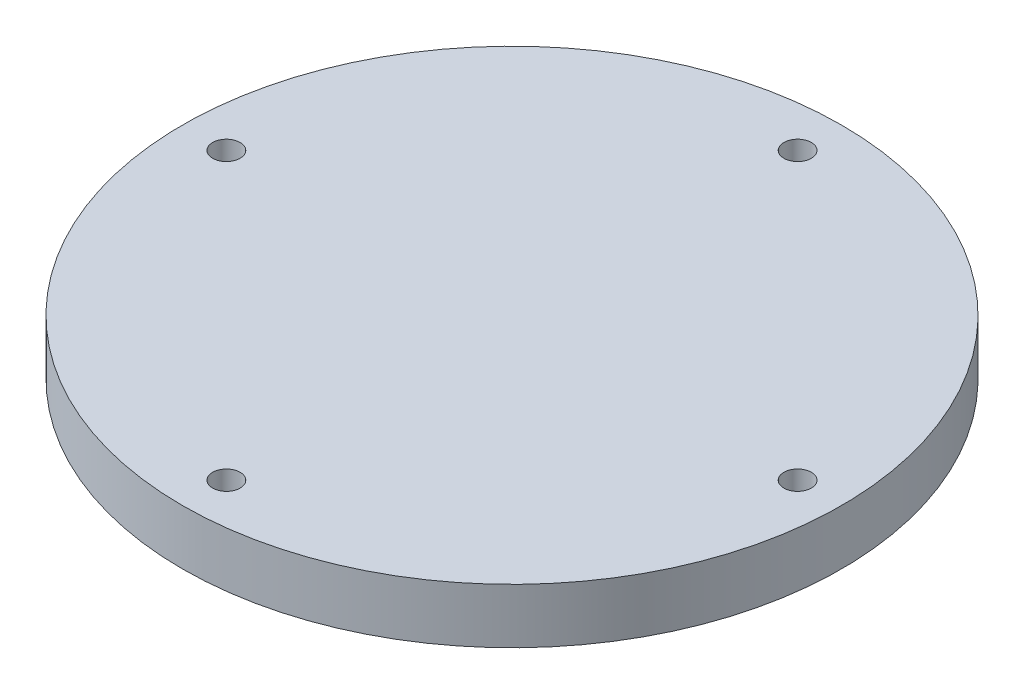
from build123d import *

# Parameters (mm, degrees)
SKETCH1_R           = 38.1
SKETCH1_R_2         = 1.5875
BOSS_EXTRUDE1_DEPTH = 6.35


with BuildPart() as part:
    # Sketch1 → Boss-Extrude1 (new body)
    with BuildSketch(Plane(origin=(0, 0, 0), x_dir=(1, 0, 0), z_dir=(0, 1, 0))):
        with Locations(Location((0, 0, 0), (0, 0, 270))):
            Circle(SKETCH1_R)
        with Locations(Location((0, 33.02, 0), (0, 0, 270))):
            Circle(SKETCH1_R_2, mode=Mode.SUBTRACT)
        with Locations(Location((33.02, 0, 0), (0, 0, 270))):
            Circle(SKETCH1_R_2, mode=Mode.SUBTRACT)
        with Locations(Location((0, -33.02, 0), (0, 0, 270))):
            Circle(SKETCH1_R_2, mode=Mode.SUBTRACT)
        with Locations(Location((-33.02, 0, 0), (0, 0, 270))):
            Circle(SKETCH1_R_2, mode=Mode.SUBTRACT)
    extrude(amount=BOSS_EXTRUDE1_DEPTH)


solid = part.part
